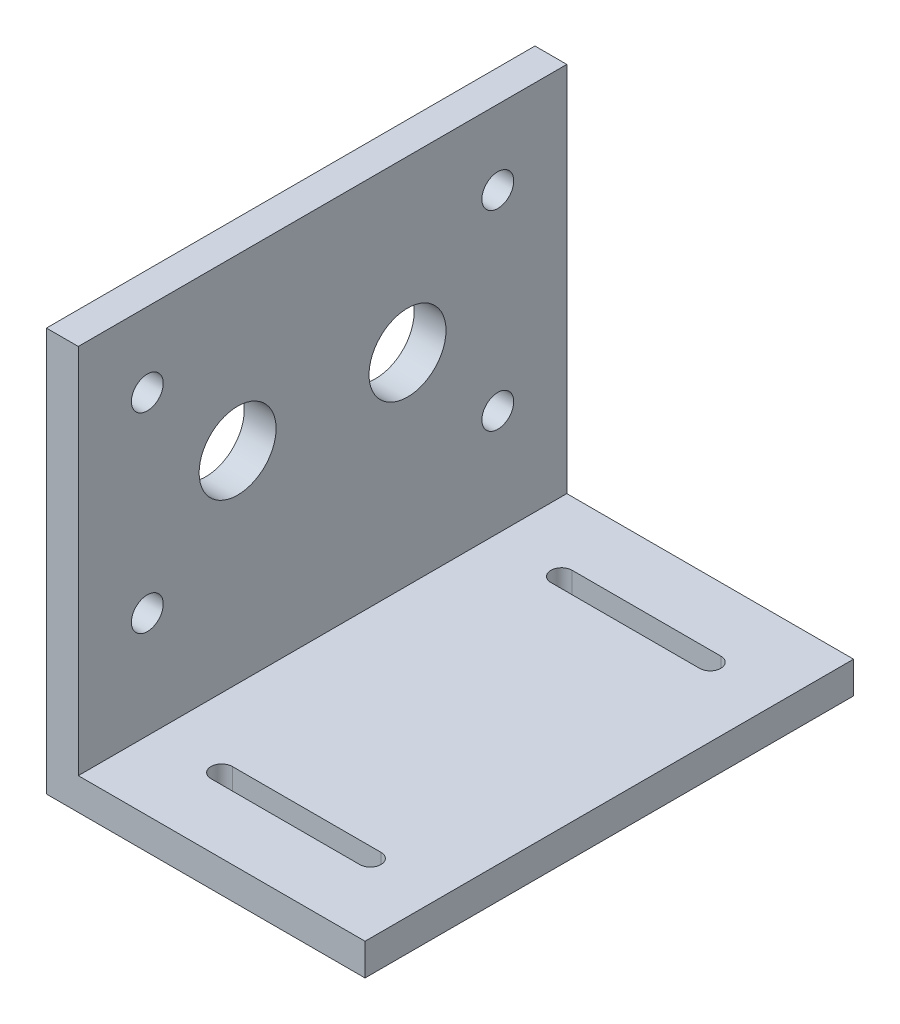
from build123d import *

# Parameters (mm, degrees)
BOSS_EXTRUDE1_DEPTH = 46
SKETCH2_R           = 3.625
CUT_EXTRUDE1_DEPTH  = 46
SKETCH3_R           = 1.5
CUT_EXTRUDE2_DEPTH  = 10
CUT_EXTRUDE3_DEPTH  = 10


with BuildPart() as part:
    # Sketch1 → Boss-Extrude1 (new body)
    with BuildSketch(Plane.XY):
        Polygon((0, 0), (30, 0), (30, 3), (3, 3), (3, 38), (0, 38), align=None)
    extrude(amount=BOSS_EXTRUDE1_DEPTH)

    # Sketch2 → Cut-Extrude1 (cut)
    with BuildSketch(Plane(origin=(3, 0, 0), x_dir=(0, 0, -1), z_dir=(1, 0, 0))):
        with Locations((-15, 22)):
            Circle(SKETCH2_R)
        with Locations((-31, 22)):
            Circle(SKETCH2_R)
    extrude(amount=-CUT_EXTRUDE1_DEPTH, mode=Mode.SUBTRACT)

    # Sketch3 → Cut-Extrude2 (cut)
    with BuildSketch(Plane.ZY):
        with Locations((39.5, 31)):
            Circle(SKETCH3_R)
        with Locations((6.5, 31)):
            Circle(SKETCH3_R)
        with Locations((39.5, 13)):
            Circle(SKETCH3_R)
        with Locations((6.5, 13)):
            Circle(SKETCH3_R)
    extrude(amount=-CUT_EXTRUDE2_DEPTH, mode=Mode.SUBTRACT)

    # Sketch4 → Cut-Extrude3 (cut)
    with BuildSketch(Plane(origin=(0, 3, 0), x_dir=(1, 0, 0), z_dir=(0, 1, 0))):
        with BuildLine():
            Line((9.5, -38), (23.5, -38))
            ThreePointArc((23.5, -38), (24.5, -39), (23.5, -40))
            Line((23.5, -40), (9.5, -40))
            ThreePointArc((9.5, -40), (8.5, -39), (9.5, -38))
        make_face()
        with BuildLine():
            Line((9.5, -6), (23.5, -6))
            ThreePointArc((23.5, -6), (24.5, -7), (23.5, -8))
            Line((23.5, -8), (9.5, -8))
            ThreePointArc((9.5, -8), (8.5, -7), (9.5, -6))
        make_face()
    extrude(amount=-CUT_EXTRUDE3_DEPTH, mode=Mode.SUBTRACT)


solid = part.part
